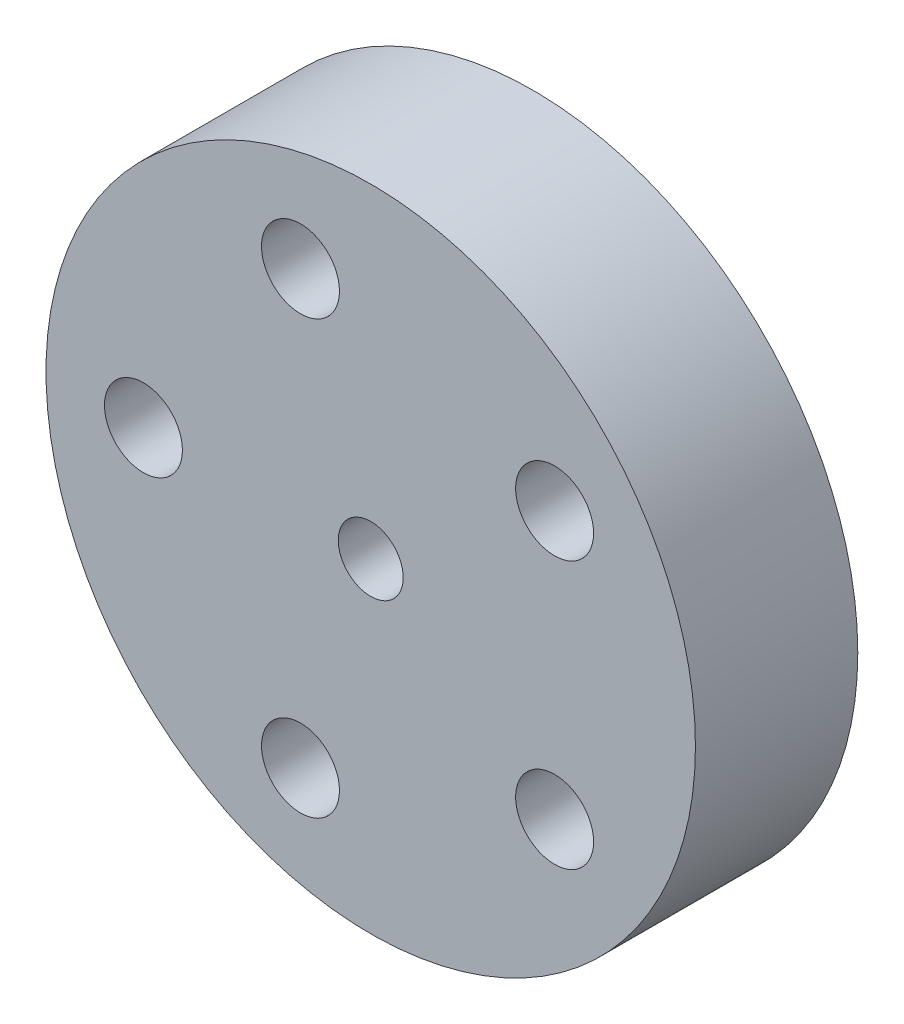
from build123d import *

# Parameters (mm, degrees)
SKETCH1_R           = 6.35
SKETCH1_R_2         = 0.635
BOSS_EXTRUDE1_DEPTH = 3.175
SKETCH2_R           = 0.762
CUT_EXTRUDE1_DEPTH  = 10.525


with BuildPart() as part:
    # Sketch1 → Boss-Extrude1 (new body)
    with BuildSketch(Plane.XY):
        Circle(SKETCH1_R)
        Circle(SKETCH1_R_2, mode=Mode.SUBTRACT)
    extrude(amount=BOSS_EXTRUDE1_DEPTH)

    # Sketch2 → Cut-Extrude1 (cut, through all)
    with BuildSketch(Plane.XY.offset(3.175)):
        with Locations((-4.445, 0)):
            Circle(SKETCH2_R)
        with Locations((-1.37358054, 4.227446215)):
            Circle(SKETCH2_R)
        with Locations((3.59608054, 2.612705446)):
            Circle(SKETCH2_R)
        with Locations((3.59608054, -2.612705446)):
            Circle(SKETCH2_R)
        with Locations((-1.37358054, -4.227446215)):
            Circle(SKETCH2_R)
    extrude(amount=-CUT_EXTRUDE1_DEPTH, mode=Mode.SUBTRACT)


solid = part.part
